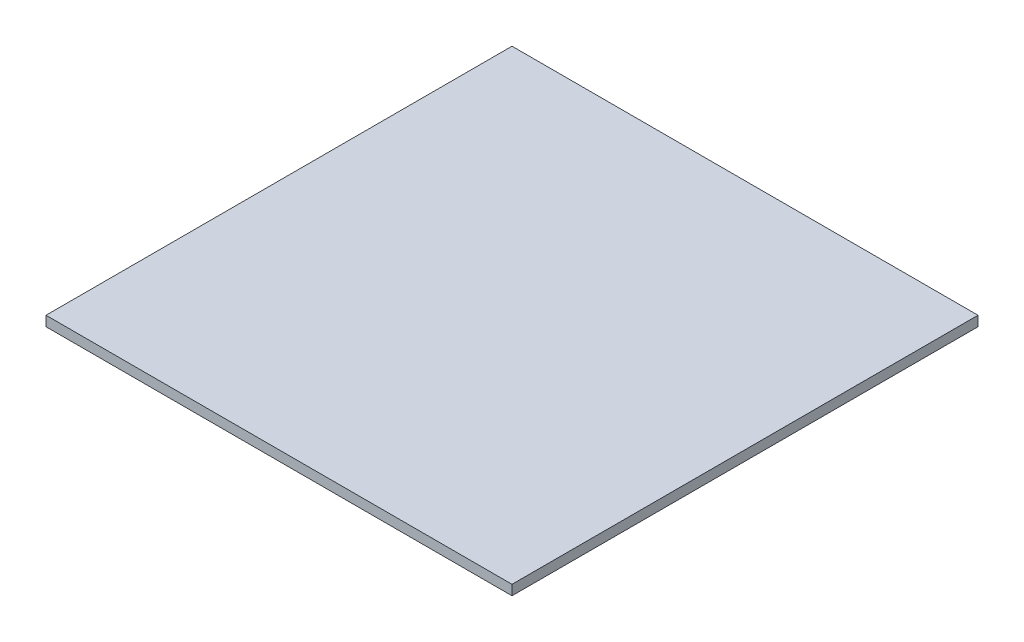
from build123d import *

# Parameters (mm, degrees)
SKETCH2_W           = 93.5
SKETCH2_H           = 93.5
BOSS_EXTRUDE1_DEPTH = 2


with BuildPart() as part:
    # Sketch2 → Boss-Extrude1 (new body)
    with BuildSketch(Plane(origin=(0, 0, 0), x_dir=(1, 0, 0), z_dir=(0, 1, 0))):
        with Locations((95.745652174, 3.906521739)):
            Rectangle(SKETCH2_W, SKETCH2_H)
    extrude(amount=BOSS_EXTRUDE1_DEPTH)


solid = part.part
